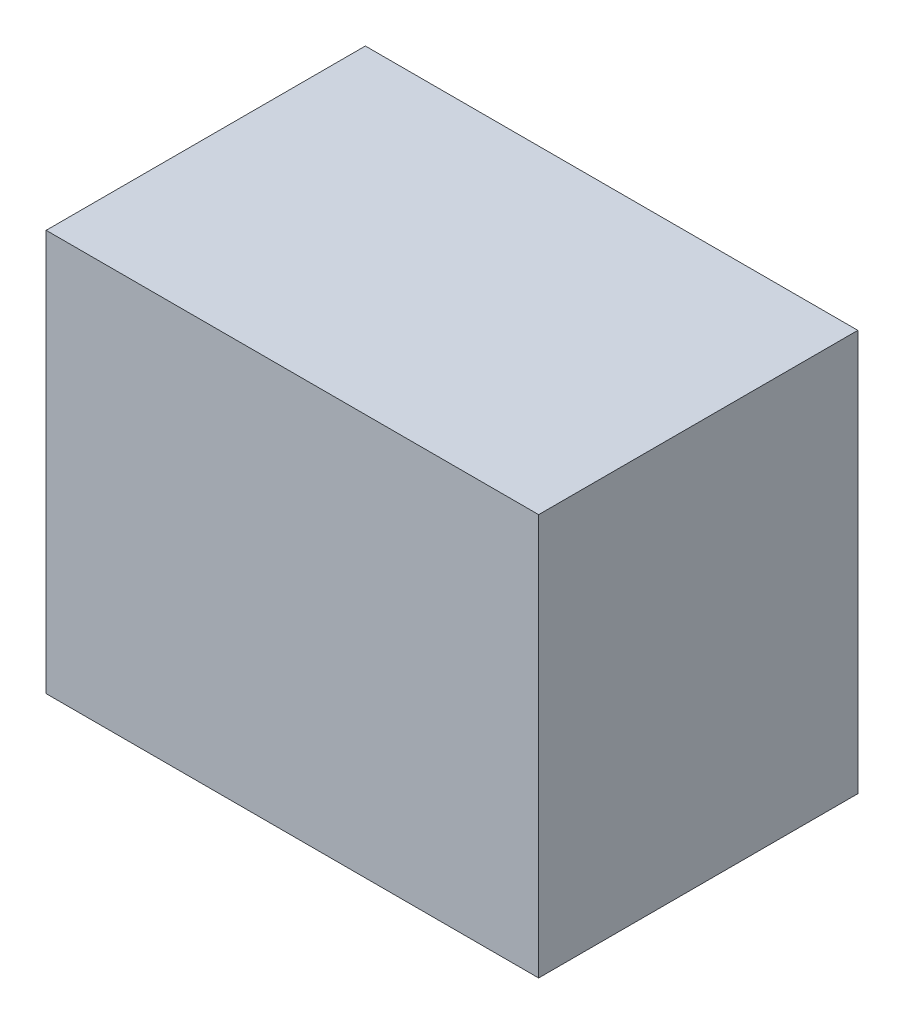
from build123d import *

# Parameters (mm, degrees)
SZKIC1_W                    = 270
SZKIC1_H                    = 175
DODANIE_WYCI_GNI_CIE1_DEPTH = 220


with BuildPart() as part:
    # Szkic1 → Dodanie-wyciągnięcie1 (new body)
    with BuildSketch(Plane(origin=(0, 0, 0), x_dir=(1, 0, 0), z_dir=(0, 1, 0))):
        Rectangle(SZKIC1_W, SZKIC1_H)
    extrude(amount=DODANIE_WYCI_GNI_CIE1_DEPTH)


solid = part.part
